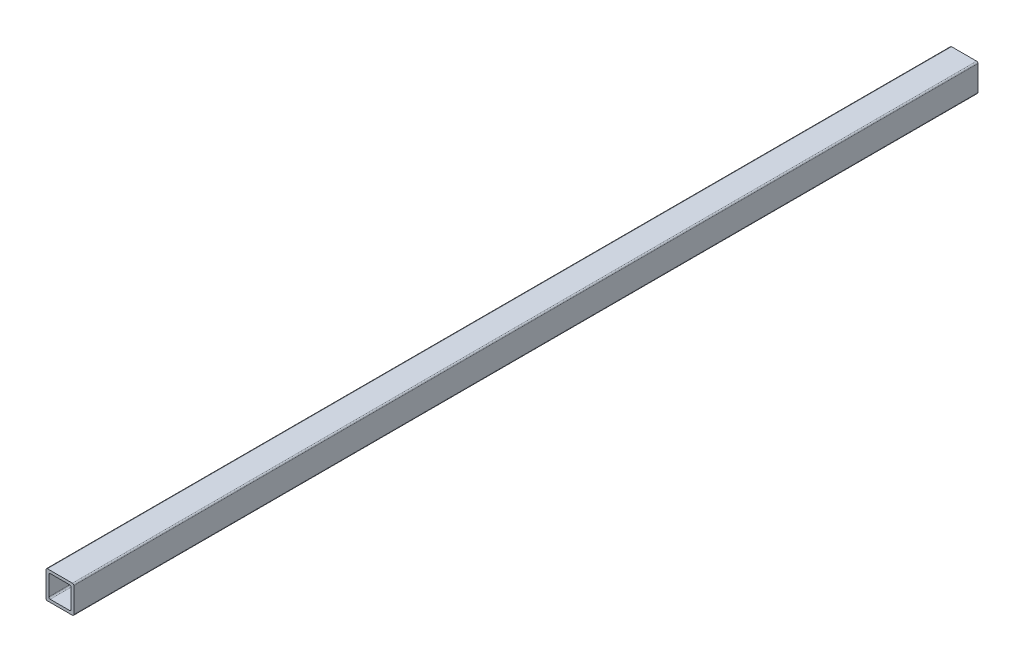
from build123d import *

# Parameters (mm, degrees)
BOSS_EXTRU_1_DEPTH = 1300


with BuildPart() as part:
    # Esquisse2 → Boss.-Extru.1 (new body)
    with BuildSketch(Plane.XY):
        with BuildLine():
            Line((2, 0), (38, 0))
            ThreePointArc((38, 0), (39.414213562, 0.585786438), (40, 2))
            Line((40, 2), (40, 38))
            ThreePointArc((40, 38), (39.414213562, 39.414213562), (38, 40))
            Line((38, 40), (2, 40))
            ThreePointArc((2, 40), (0.585786438, 39.414213562), (0, 38))
            Line((0, 38), (0, 2))
            ThreePointArc((0, 2), (0.585786438, 0.585786438), (2, 0))
        make_face()
        with BuildLine():
            Line((6, 4), (34, 4))
            ThreePointArc((34, 4), (35.414213562, 4.585786438), (36, 6))
            Line((36, 6), (36, 34))
            ThreePointArc((36, 34), (35.414213562, 35.414213562), (34, 36))
            Line((34, 36), (6, 36))
            ThreePointArc((6, 36), (4.585786438, 35.414213562), (4, 34))
            Line((4, 34), (4, 6))
            ThreePointArc((4, 6), (4.585786438, 4.585786438), (6, 4))
        make_face(mode=Mode.SUBTRACT)
    extrude(amount=BOSS_EXTRU_1_DEPTH)


solid = part.part
